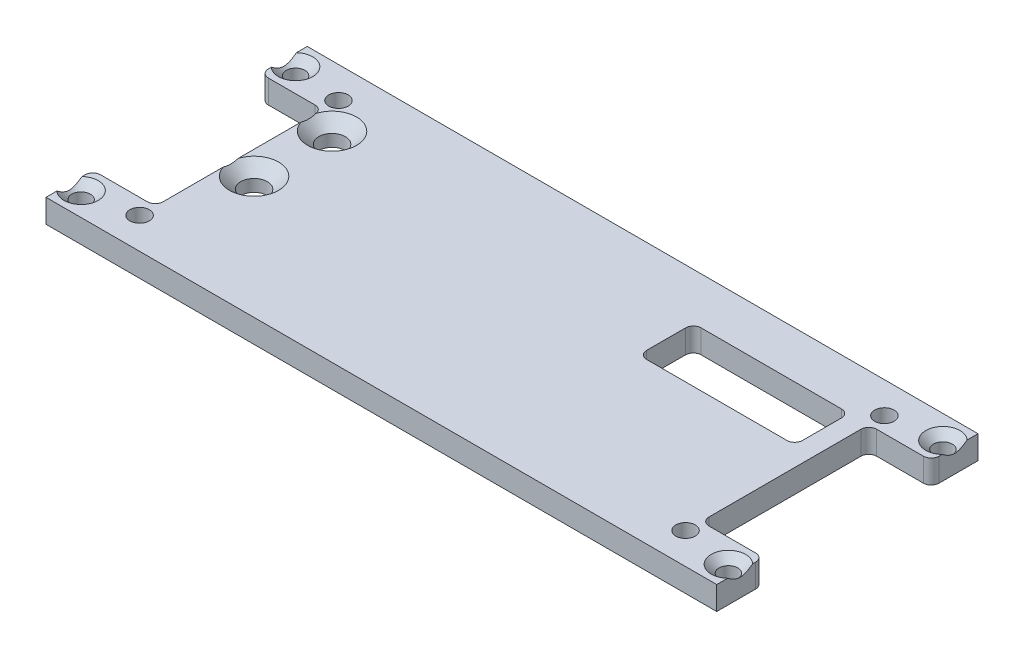
from build123d import *

# Parameters (mm, degrees)
SKETCH1_W                                           = 86
SKETCH1_H                                           = 33.5
SKETCH1_W_2                                         = 20
SKETCH1_H_2                                         = 7
BOSS_EXTRUDE1_DEPTH                                 = 1.5
CSK_FOR_M3_COUNTERSUNK_FLAT_HEAD_SCREW1_D           = 3.4
CSK_FOR_M3_COUNTERSUNK_FLAT_HEAD_SCREW1_DEPTH       = 6
CSK_FOR_M3_COUNTERSUNK_FLAT_HEAD_SCREW1_CSINK_D     = 6.3
CSK_FOR_M3_COUNTERSUNK_FLAT_HEAD_SCREW1_CSINK_ANGLE = 90
CSK_FOR_M3_COUNTERSUNK_FLAT_HEAD_SCREW1_TIP         = 1.021463052
TAP_DRILL_FOR_M3_TAP1_D                             = 2.5
SKETCH13_W                                          = 3.5
SKETCH13_H                                          = 18
CUT_EXTRUDE3_DEPTH                                  = 48.943325917
CSK_FOR_M2_COUNTERSUNK_FLAT_HEAD_SCREW3_D           = 2.4
CSK_FOR_M2_COUNTERSUNK_FLAT_HEAD_SCREW3_DEPTH       = 4
CSK_FOR_M2_COUNTERSUNK_FLAT_HEAD_SCREW3_CSINK_D     = 4.4
CSK_FOR_M2_COUNTERSUNK_FLAT_HEAD_SCREW3_CSINK_ANGLE = 90
CSK_FOR_M2_COUNTERSUNK_FLAT_HEAD_SCREW3_TIP         = 0.721032743
SKETCH21_W                                          = 8
SKETCH21_H                                          = 21.5
CUT_EXTRUDE4_DEPTH                                  = 47.244594279
FILLET2_R                                           = 1


with BuildPart() as part:
    # Sketch1 → Boss-Extrude1 (new, symmetric)
    with BuildSketch(Plane(origin=(0, 0, 0), x_dir=(1, 0, 0), z_dir=(0, 1, 0))):
        Rectangle(SKETCH1_W, SKETCH1_H)
        with Locations((22.5, 7.25)):
            Rectangle(SKETCH1_W_2, SKETCH1_H_2, mode=Mode.SUBTRACT)
    extrude(amount=BOSS_EXTRUDE1_DEPTH, both=True)

    # CSK for M3 Countersunk Flat Head Screw1
    with Locations(Plane(origin=(0, 1.5, 0), x_dir=(1, 0, 0), z_dir=(0, 1, 0))):
        with Locations((-32, 8.93052757), (-32, -1.06947243)):
            CounterSinkHole(CSK_FOR_M3_COUNTERSUNK_FLAT_HEAD_SCREW1_D / 2, CSK_FOR_M3_COUNTERSUNK_FLAT_HEAD_SCREW1_CSINK_D / 2, depth=CSK_FOR_M3_COUNTERSUNK_FLAT_HEAD_SCREW1_DEPTH, counter_sink_angle=CSK_FOR_M3_COUNTERSUNK_FLAT_HEAD_SCREW1_CSINK_ANGLE)
            with Locations((0, 0, -(CSK_FOR_M3_COUNTERSUNK_FLAT_HEAD_SCREW1_DEPTH + CSK_FOR_M3_COUNTERSUNK_FLAT_HEAD_SCREW1_TIP / 2))):  # 118° drill point
                Cone(0, CSK_FOR_M3_COUNTERSUNK_FLAT_HEAD_SCREW1_D / 2, CSK_FOR_M3_COUNTERSUNK_FLAT_HEAD_SCREW1_TIP, mode=Mode.SUBTRACT)

    # Tap Drill for M3 Tap1 (through all)
    with Locations(Plane(origin=(0, 1.5, 0), x_dir=(1, 0, 0), z_dir=(0, 1, 0))):
        with Locations((-35, 12.75), (-35, -12.75), (35, -12.75), (35, 12.75)):
            Hole(TAP_DRILL_FOR_M3_TAP1_D / 2)

    # Sketch13 → Cut-Extrude3 (cut, through all)
    with BuildSketch(Plane.XZ.offset(11.5)):
        with Locations((-38.25, -0.25)):
            Rectangle(SKETCH13_W, SKETCH13_H)
    extrude(amount=-CUT_EXTRUDE3_DEPTH, mode=Mode.SUBTRACT)

    # CSK for M2 Countersunk Flat Head Screw3
    with Locations(Plane(origin=(0, 1.5, 0), x_dir=(1, 0, 0), z_dir=(0, 1, 0))):
        with Locations((-41.5, -13.75), (-41.5, 13.75), (41.5, 13.75), (41.5, -13.75)):
            CounterSinkHole(CSK_FOR_M2_COUNTERSUNK_FLAT_HEAD_SCREW3_D / 2, CSK_FOR_M2_COUNTERSUNK_FLAT_HEAD_SCREW3_CSINK_D / 2, depth=CSK_FOR_M2_COUNTERSUNK_FLAT_HEAD_SCREW3_DEPTH, counter_sink_angle=CSK_FOR_M2_COUNTERSUNK_FLAT_HEAD_SCREW3_CSINK_ANGLE)
            with Locations((0, 0, -(CSK_FOR_M2_COUNTERSUNK_FLAT_HEAD_SCREW3_DEPTH + CSK_FOR_M2_COUNTERSUNK_FLAT_HEAD_SCREW3_TIP / 2))):  # 118° drill point
                Cone(0, CSK_FOR_M2_COUNTERSUNK_FLAT_HEAD_SCREW3_D / 2, CSK_FOR_M2_COUNTERSUNK_FLAT_HEAD_SCREW3_TIP, mode=Mode.SUBTRACT)

    # Sketch21 → Cut-Extrude4 (cut, through all)
    with BuildSketch(Plane(origin=(0, 1.5, 0), x_dir=(1, 0, 0), z_dir=(0, 1, 0))):
        with Locations((-39, 0)):
            Rectangle(SKETCH21_W, SKETCH21_H)
        with Locations((39, 0)):
            Rectangle(SKETCH21_W, SKETCH21_H)
    extrude(amount=-CUT_EXTRUDE4_DEPTH, mode=Mode.SUBTRACT)

    # Fillet2
    fillet2_edges = [part.edges().sort_by_distance(p)[0] for p in [
        (35, 0, 10.75),
        (43, 0, 10.75),
        (43, 0, -10.75),
        (35, 0, -10.75),
        (-43, 0, 10.75),
        (-35, 0, 10.75),
        (-43, 0, -10.75),
        (-35, 0, -10.75),
        (12.5, 0, -3.75),
        (32.5, 0, -3.75),
        (32.5, 0, -10.75),
        (12.5, 0, -10.75),
    ]]
    fillet(fillet2_edges, radius=FILLET2_R)


solid = part.part
